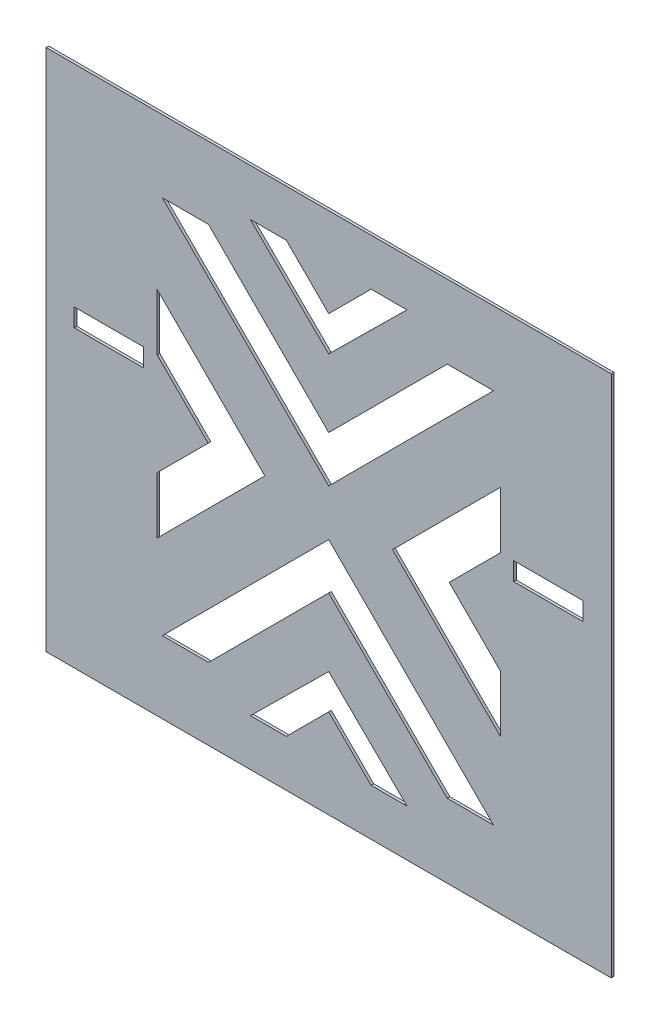
from build123d import *

# Parameters (mm, degrees)
SKETCH_1_W          = 216
SKETCH_1_H          = 200
EXTRUDE_1_DEPTH     = 1
CUT_EXTRUDE_2_DEPTH = 148.190352945
CUT_EXTRUDE_3_DEPTH = 148.190352945
SKETCH_4_W          = 26.549290854
SKETCH_4_H          = 6.938085034
CUT_EXTRUDE_4_DEPTH = 148.190352945


with BuildPart() as part:
    # 草图1 → 凸台-拉伸1 (new body)
    with BuildSketch(Plane.XY):
        Rectangle(SKETCH_1_W, SKETCH_1_H)
    extrude(amount=EXTRUDE_1_DEPTH)

    # 草图2 → 切除-拉伸2 (cut, through all)
    with BuildSketch(Plane.XY.offset(1)):
        Polygon((-29.908359309, 82.116750483), (0, 52.560653053), (29.908359309, 82.116750483), (16.210763117, 82.116750483), (0, 65.905987366), (-16.210763117, 82.116750483), align=None)
        Polygon((0, 26.550736561), (-45.925349273, 72.476085834), (-63.582203523, 72.476085834), (0, 8.893882312), (62.972238909, 71.866121221), (45.31538466, 71.866121221), align=None)
    cut_extrude_2 = extrude(amount=-CUT_EXTRUDE_2_DEPTH, mode=Mode.SUBTRACT)

    # 镜向2: 切除-拉伸2 across plane
    add(cut_extrude_2.mirror(Plane.ZX), mode=Mode.SUBTRACT)

    # 草图3 → 切除-拉伸3 (cut, through all)
    with BuildSketch(Plane.XY.offset(1)):
        Polygon((-46.068138611, 0), (-65.582203523, 19.514064912), (-65.582203523, 41.170919161), (-24.411284361, 0), (-65.582203523, -41.170919161), (-65.582203523, -19.514064912), align=None)
    cut_extrude_3 = extrude(amount=-CUT_EXTRUDE_3_DEPTH, mode=Mode.SUBTRACT)

    # 镜向3: 切除-拉伸3 across plane
    add(cut_extrude_3.mirror(Plane(origin=(0, 0, 0), x_dir=(0, 0, 1), z_dir=(1, 0, 0))), mode=Mode.SUBTRACT)

    # 草图4 → 切除-拉伸4 (cut, through all)
    with BuildSketch(Plane.XY.offset(1)):
        with Locations((-83.979598966, 16.045022395)):
            Rectangle(SKETCH_4_W, SKETCH_4_H)
    cut_extrude_4 = extrude(amount=-CUT_EXTRUDE_4_DEPTH, mode=Mode.SUBTRACT)

    # 镜向4: 切除-拉伸4 across plane
    add(cut_extrude_4.mirror(Plane(origin=(0, 0, 0), x_dir=(0, 0, 1), z_dir=(1, 0, 0))), mode=Mode.SUBTRACT)


solid = part.part
